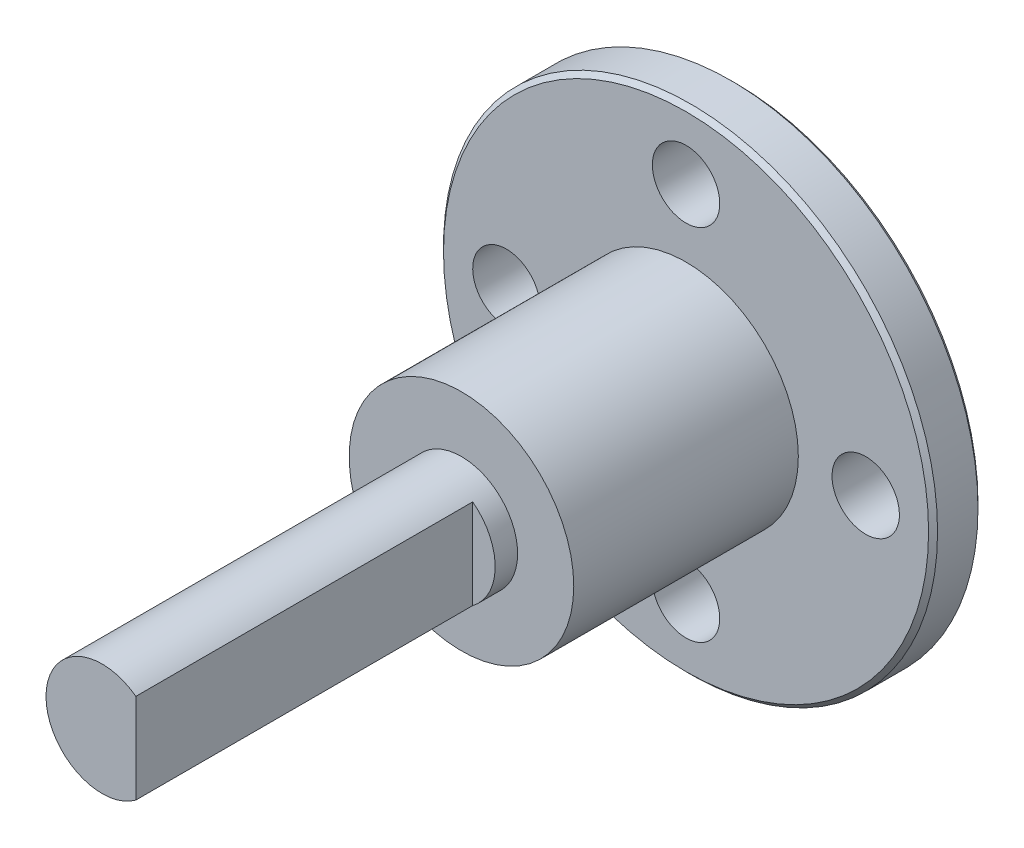
from build123d import *

# Parameters (mm, degrees)
SKETCH_1_R               = 11
SKETCH_1_R_2             = 5
EXTRUDE_1_DEPTH          = 2.2
SKETCH_2_R               = 5
EXTRUDE_2_DEPTH          = 10
F_3_0MM_1_D              = 3
PATTERN_CIRCULAR_1_COUNT = 4
CHAMFER_3_SIZE           = 0.2
SKETCH_12_R              = 2.5
EXTRUDE_1789_DEPTH       = 26
CUT_EXTRUDE_START        = -15
CUT_EXTRUDE_1_DEPTH      = 15


with BuildPart() as part:
    # 草图1 → 凸台-拉伸1 (new body)
    # profile 1 of 2: a face of its own
    with BuildSketch(Plane.XY):
        Circle(SKETCH_1_R)
        Circle(SKETCH_1_R_2, mode=Mode.SUBTRACT)
    # profile 2 of 2: a face of its own
    with BuildSketch(Plane.XY):
        Circle(SKETCH_1_R_2)
    extrude(amount=EXTRUDE_1_DEPTH)

    # 草图2 → 凸台-拉伸2 (add)
    with BuildSketch(Plane.XY.offset(2.2)):
        Circle(SKETCH_2_R)
    extrude(amount=EXTRUDE_2_DEPTH)

    # Ø3.0mm 暗销孔1 (through all)
    with Locations(Plane.XY.offset(2.2)):
        with Locations((0, 8)):
            f_3_0mm_1 = Hole(F_3_0MM_1_D / 2)

    # 阵列(圆周)1: Ø3.0mm 暗销孔1 ×4 about axis
    pattern_circular_1_axis = Axis((0, 0, 0), (0, 0, 1))
    for i in range(1, PATTERN_CIRCULAR_1_COUNT):
        add(f_3_0mm_1.rotate(pattern_circular_1_axis, i * 360 / PATTERN_CIRCULAR_1_COUNT), mode=Mode.SUBTRACT)

    # 倒角3
    chamfer_3_edges = [part.edges().sort_by_distance(p)[0] for p in [
        (-11, 0, 0),
        (-11, 0, 2.2),
    ]]
    chamfer(chamfer_3_edges, length=CHAMFER_3_SIZE)

    # 草图12 → Extrude 1789 (add)
    with BuildSketch(Plane.XY.offset(2.2)):
        with Locations(Location((0, 0, 0), (0, 0, 180))):
            Circle(SKETCH_12_R)
    extrude(amount=EXTRUDE_1789_DEPTH)

    # 草图13 → 切除-拉伸1 (cut)
    with BuildSketch(Plane.XY.offset(28.2).offset(CUT_EXTRUDE_START)):
        with BuildLine():
            Line((1.5, 2), (1.5, -2))
            ThreePointArc((1.5, -2), (2.5, 0), (1.5, 2))
        make_face()
    extrude(amount=CUT_EXTRUDE_1_DEPTH, mode=Mode.SUBTRACT)


solid = part.part
